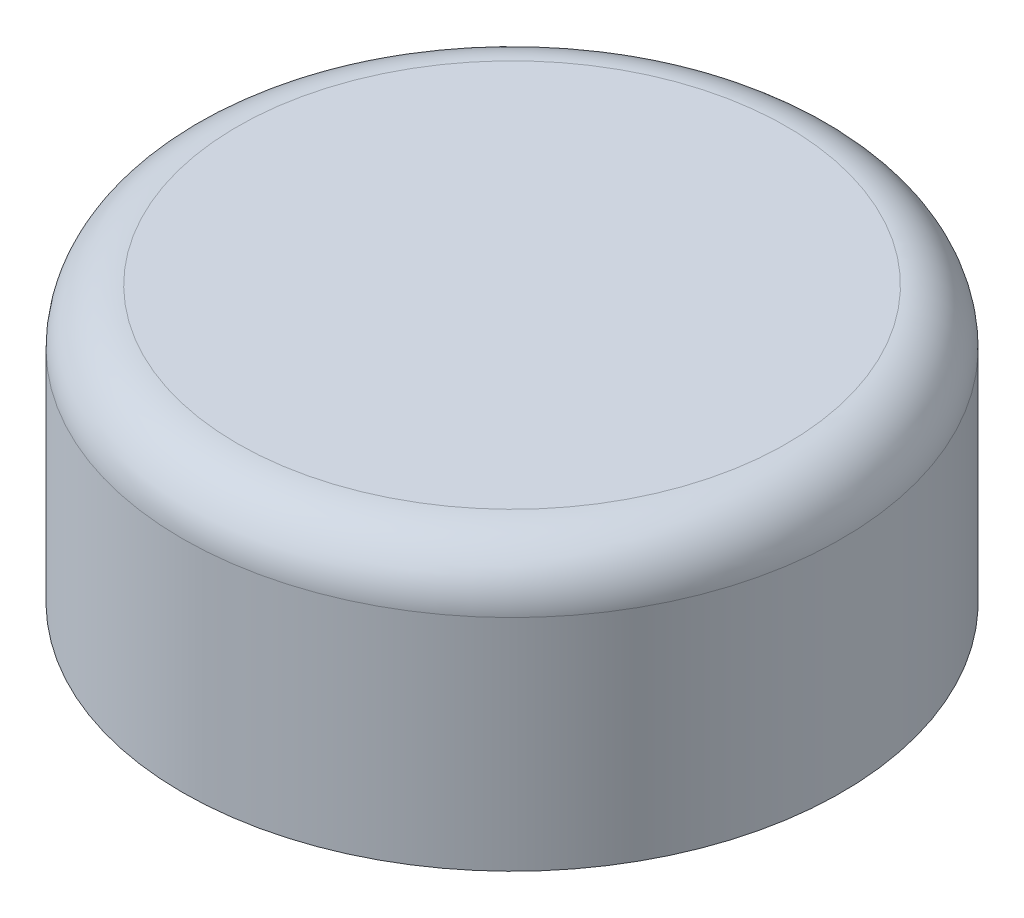
from build123d import *

# Parameters (mm, degrees)
SKETCH1_R           = 12
BOSS_EXTRUDE1_DEPTH = 10
FILLET1_R           = 2


with BuildPart() as part:
    # Sketch1 → Boss-Extrude1 (new body)
    with BuildSketch(Plane(origin=(0, 0, 0), x_dir=(1, 0, 0), z_dir=(0, 1, 0))):
        with Locations(Location((0, 0, 0), (0, 0, 270))):
            Circle(SKETCH1_R)
    extrude(amount=BOSS_EXTRUDE1_DEPTH)

    # Fillet1
    fillet1_edges = [part.edges().sort_by_distance(p)[0] for p in [
        (0, 10, -12),
    ]]
    fillet(fillet1_edges, radius=FILLET1_R)


solid = part.part
